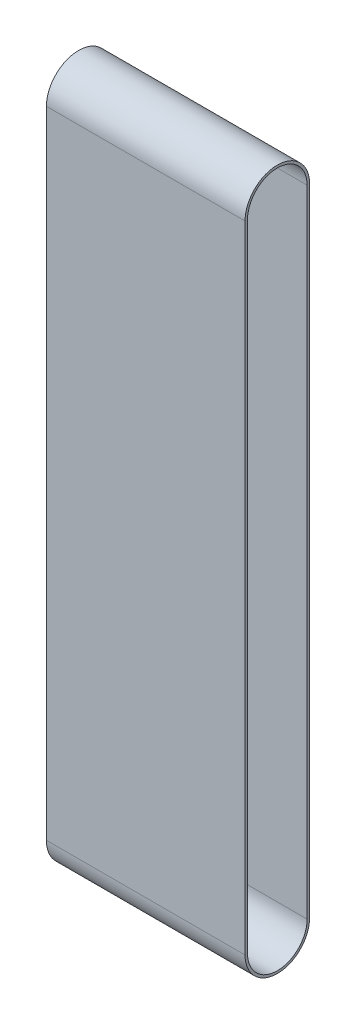
from build123d import *

# Parameters (mm, degrees)
BOSS_EXTRUDE1_DEPTH = 254


with BuildPart() as part:
    # Sketch1 → Boss-Extrude1 (new, symmetric)
    with BuildSketch(Plane(origin=(0, 0, 0), x_dir=(0, 0, -1), z_dir=(1, 0, 0))):
        with BuildLine():
            Line((247.65, 254), (247.65, 1879.6))
            ThreePointArc((247.65, 1879.6), (330.2, 1962.15), (412.75, 1879.6))
            Line((412.75, 1879.6), (412.75, 254))
            ThreePointArc((412.75, 254), (330.2, 171.45), (247.65, 254))
        make_face()
        with BuildLine():
            Line((406.4, 1879.6), (406.4, 254))
            ThreePointArc((406.4, 254), (330.2, 177.8), (254, 254))
            Line((254, 254), (254, 1879.6))
            ThreePointArc((254, 1879.6), (330.2, 1955.8), (406.4, 1879.6))
        make_face(mode=Mode.SUBTRACT)
    extrude(amount=BOSS_EXTRUDE1_DEPTH, both=True)


solid = part.part
